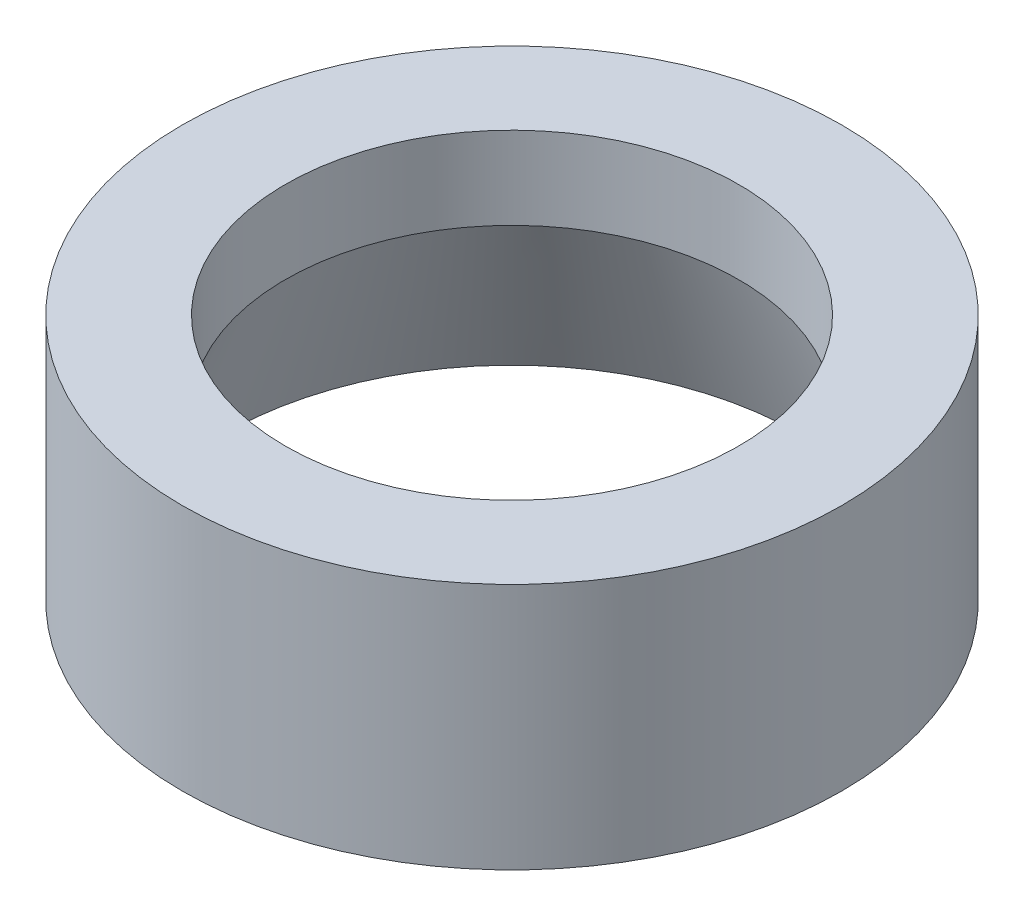
from build123d import *


with BuildPart() as part:
    # Sketch1 → Revolve1 (revolve)
    with BuildSketch(Plane.XY, mode=Mode.PRIVATE) as revolve1_sk:
        Polygon((4, 1.5), (4, -1.5), (3.5, -1.5), (2.75, 0.5), (2.75, 1.5), align=None)
    revolve(revolve1_sk.sketch.rotate(Axis((0, 1.5, 0), (0, -1, 0)), 90), axis=Axis((0, 1.5, 0), (0, -1, 0)))


solid = part.part
